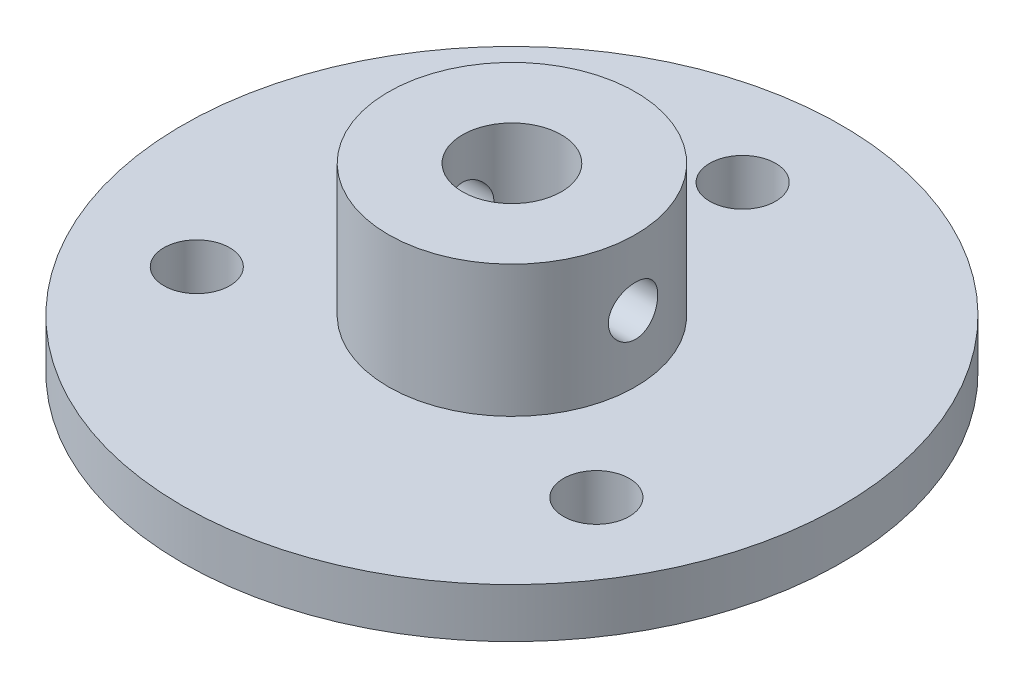
from build123d import *

# Parameters (mm, degrees)
CROQUIS1_R                 = 20
CROQUIS1_R_2               = 2
CROQUIS1_R_3               = 3
SALIENTE_EXTRUIR1_DEPTH    = 3
CROQUIS2_R                 = 7.5
CROQUIS2_R_2               = 3
SALIENTE_EXTRUIR2_DEPTH    = 8
CORTAR_EXTRUIR1_DEPTH      = 31.347981811
CORTAR_EXTRUIR1_DEPTH_BACK = 31.347981811
CROQUIS3_R                 = 1.5


with BuildPart() as part:
    # Croquis1 → Saliente-Extruir1 (new body)
    with BuildSketch(Plane(origin=(0, 0, 0), x_dir=(1, 0, 0), z_dir=(0, 1, 0))):
        with Locations(Location((0, 0, 0), (0, 0, 270))):
            Circle(CROQUIS1_R)
        with Locations(Location((0, 14, 0), (0, 0, 270))):
            Circle(CROQUIS1_R_2, mode=Mode.SUBTRACT)
        with Locations(Location((12.124355653, -7, 0), (0, 0, 270))):
            Circle(CROQUIS1_R_2, mode=Mode.SUBTRACT)
        with Locations(Location((-12.124355653, -7, 0), (0, 0, 270))):
            Circle(CROQUIS1_R_2, mode=Mode.SUBTRACT)
        with Locations(Location((0, 0, 0), (0, 0, 270))):
            Circle(CROQUIS1_R_3, mode=Mode.SUBTRACT)
    extrude(amount=SALIENTE_EXTRUIR1_DEPTH)

    # Croquis2 → Saliente-Extruir2 (add)
    with BuildSketch(Plane(origin=(0, 3, 0), x_dir=(1, 0, 0), z_dir=(0, 1, 0))):
        with Locations(Location((0, 0, 0), (0, 0, 270))):
            Circle(CROQUIS2_R)
        with Locations(Location((0, 0, 0), (0, 0, 270))):
            Circle(CROQUIS2_R_2, mode=Mode.SUBTRACT)
    extrude(amount=SALIENTE_EXTRUIR2_DEPTH)

    # Croquis3 → Cortar-Extruir1 (cut, two sides: drawn at the far end of the back side and taken through both)
    with BuildSketch(Plane(origin=(0, 0, 0), x_dir=(0, 0, -1), z_dir=(1, 0, 0)).offset(-CORTAR_EXTRUIR1_DEPTH_BACK)):
        with Locations((0, 7)):
            Circle(CROQUIS3_R)
    extrude(amount=CORTAR_EXTRUIR1_DEPTH + CORTAR_EXTRUIR1_DEPTH_BACK, mode=Mode.SUBTRACT)


solid = part.part
